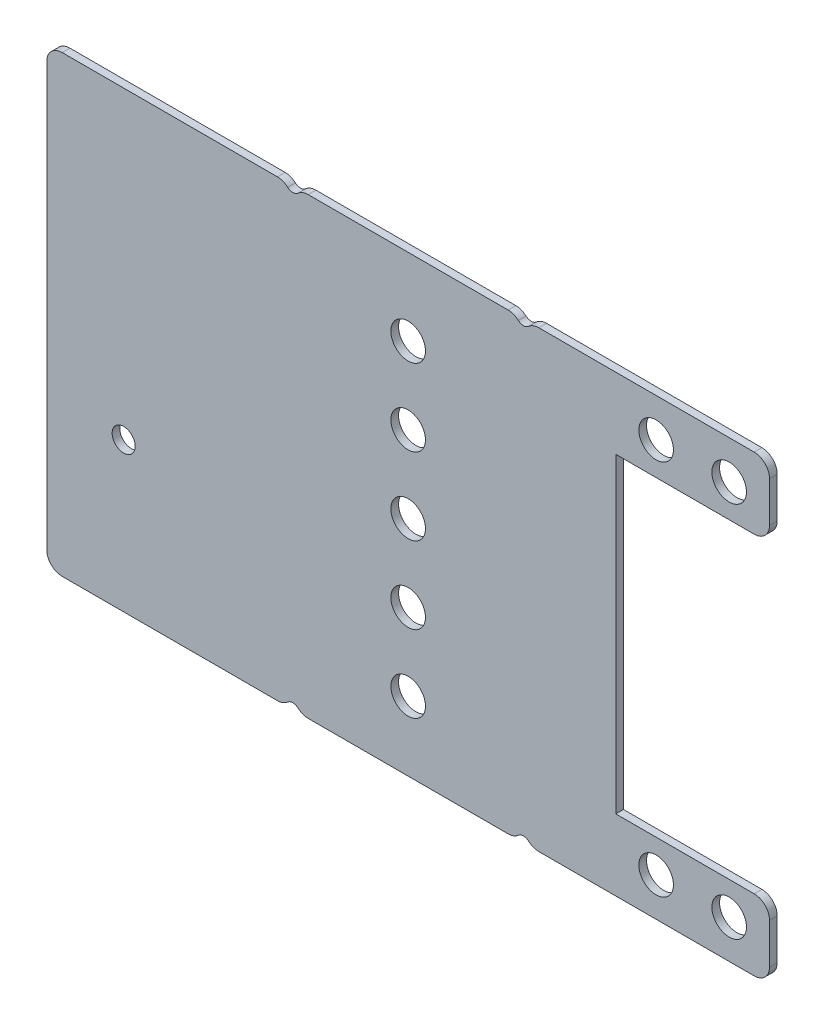
from build123d import *

# Parameters (mm, degrees)
SKETCH1_R           = 2.25
SKETCH1_R_2         = 1.5
BOSS_EXTRUDE1_DEPTH = 1


with BuildPart() as part:
    # Sketch1 → Boss-Extrude1 (new body)
    with BuildSketch(Plane.XY):
        with BuildLine():
            Line((20, 42.5), (20, 47.75))
            ThreePointArc((20, 47.75), (19.414213562, 49.164213562), (18, 49.75))
            Line((18, 49.75), (-10, 49.75))
            ThreePointArc((-10, 49.75), (-10.71364418, 49.618344718), (-11.333333333, 49.240711985))
            ThreePointArc((-11.333333333, 49.240711985), (-12, 48.986067977), (-12.666666667, 49.240711985))
            ThreePointArc((-12.666666667, 49.240711985), (-13.28635582, 49.618344718), (-14, 49.75))
            Line((-14, 49.75), (-40, 49.75))
            ThreePointArc((-40, 49.75), (-40.71364418, 49.618344718), (-41.333333333, 49.240711985))
            ThreePointArc((-41.333333333, 49.240711985), (-42, 48.986067977), (-42.666666667, 49.240711985))
            ThreePointArc((-42.666666667, 49.240711985), (-43.28635582, 49.618344718), (-44, 49.75))
            Line((-44, 49.75), (-72, 49.75))
            ThreePointArc((-72, 49.75), (-73.414213562, 49.164213562), (-74, 47.75))
            Line((-74, 47.75), (-74, -7.25))
            ThreePointArc((-74, -7.25), (-73.414213562, -8.664213562), (-72, -9.25))
            Line((-72, -9.25), (-44, -9.25))
            ThreePointArc((-44, -9.25), (-43.28635582, -9.118344718), (-42.666666667, -8.740711985))
            ThreePointArc((-42.666666667, -8.740711985), (-42, -8.486067977), (-41.333333333, -8.740711985))
            ThreePointArc((-41.333333333, -8.740711985), (-40.71364418, -9.118344718), (-40, -9.25))
            Line((-40, -9.25), (-14, -9.25))
            ThreePointArc((-14, -9.25), (-13.28635582, -9.118344718), (-12.666666667, -8.740711985))
            ThreePointArc((-12.666666667, -8.740711985), (-12, -8.486067977), (-11.333333333, -8.740711985))
            ThreePointArc((-11.333333333, -8.740711985), (-10.71364418, -9.118344718), (-10, -9.25))
            Line((-10, -9.25), (18, -9.25))
            ThreePointArc((18, -9.25), (19.414213562, -8.664213562), (20, -7.25))
            Line((20, -7.25), (20, -2))
            ThreePointArc((20, -2), (19.414213562, -0.585786438), (18, 0))
            Line((18, 0), (0, 0))
            Line((0, 0), (0, 40.5))
            Line((0, 40.5), (18, 40.5))
            ThreePointArc((18, 40.5), (19.414213562, 41.085786438), (20, 42.5))
        make_face()
        with Locations((5.25, 44.75)):
            Circle(SKETCH1_R, mode=Mode.SUBTRACT)
        with Locations((14.75, 44.75)):
            Circle(SKETCH1_R, mode=Mode.SUBTRACT)
        with Locations((14.75, -4.25)):
            Circle(SKETCH1_R, mode=Mode.SUBTRACT)
        with Locations((5.25, -4.25)):
            Circle(SKETCH1_R, mode=Mode.SUBTRACT)
        with Locations((-27, 39.75)):
            Circle(SKETCH1_R, mode=Mode.SUBTRACT)
        with Locations((-27, 29.75)):
            Circle(SKETCH1_R, mode=Mode.SUBTRACT)
        with Locations((-27, 19.75)):
            Circle(SKETCH1_R, mode=Mode.SUBTRACT)
        with Locations((-27, 9.749358603)):
            Circle(SKETCH1_R, mode=Mode.SUBTRACT)
        with Locations((-27, -0.250641397)):
            Circle(SKETCH1_R, mode=Mode.SUBTRACT)
        with Locations((-64, 10.14)):
            Circle(SKETCH1_R_2, mode=Mode.SUBTRACT)
    extrude(amount=BOSS_EXTRUDE1_DEPTH)


solid = part.part
